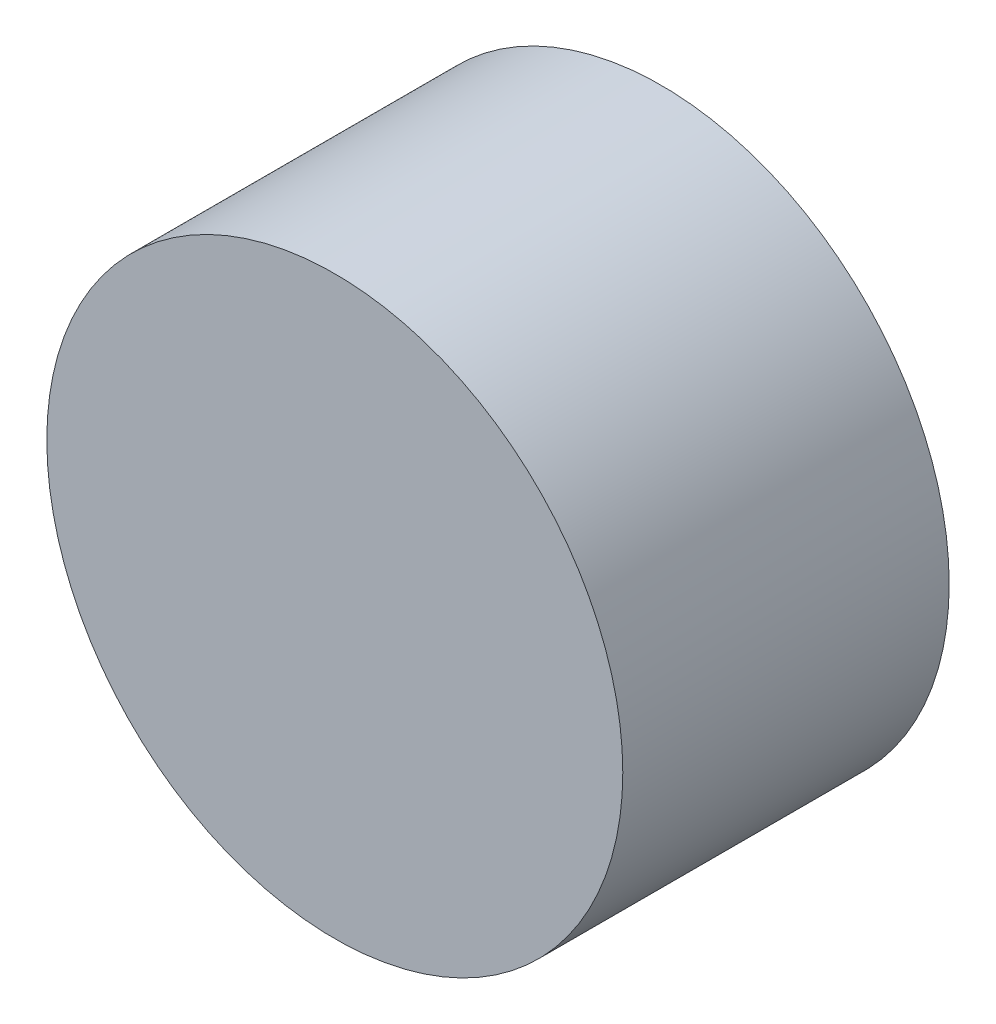
from build123d import *

# Parameters (mm, degrees)
SKETCH1_R           = 3
BOSS_EXTRUDE1_DEPTH = 3.4


with BuildPart() as part:
    # Sketch1 → Boss-Extrude1 (new body)
    with BuildSketch(Plane.XY):
        Circle(SKETCH1_R)
    extrude(amount=BOSS_EXTRUDE1_DEPTH)


solid = part.part
